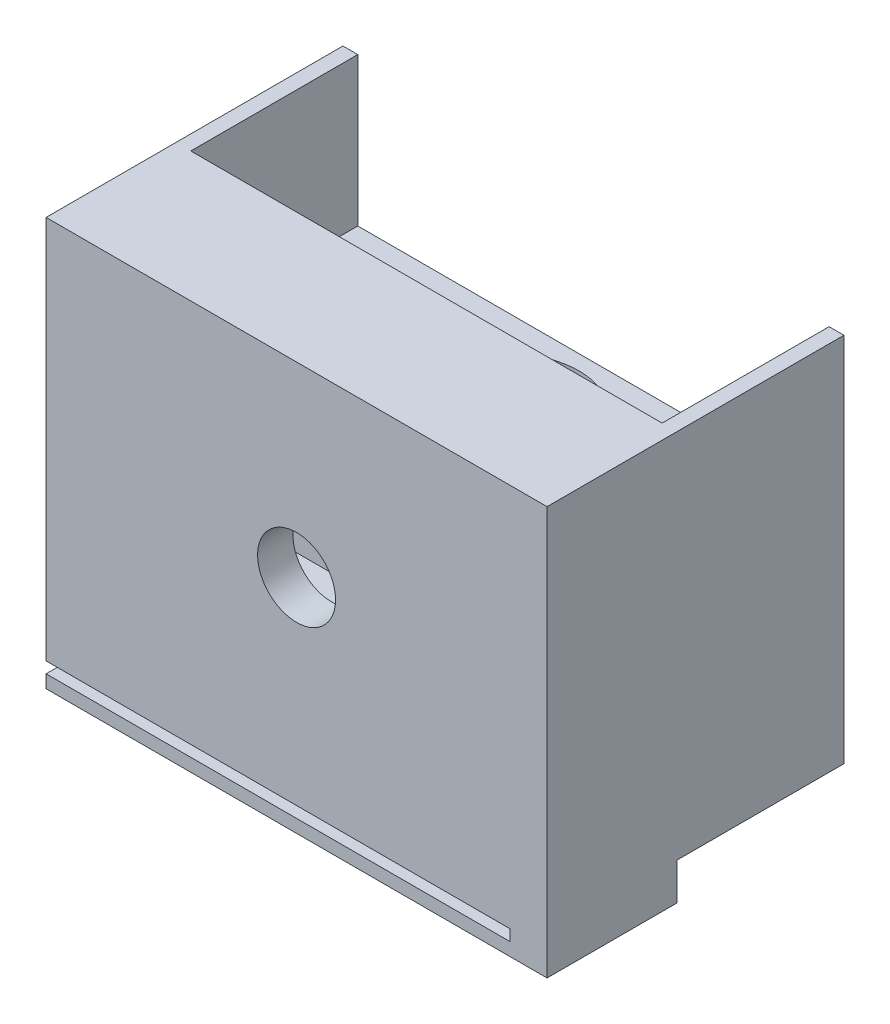
from build123d import *

# Parameters (mm, degrees)
SKETCH1_R           = 13.5
SKETCH1_R_2         = 18.5
BOSS_EXTRUDE1_DEPTH = 100
CUT_EXTRUDE1_DEPTH  = 11.5
SKETCH4_R           = 0.7
CUT_EXTRUDE2_DEPTH  = 10
SKETCH5_W           = 127
SKETCH5_H           = 47.647991038
CUT_EXTRUDE3_DEPTH  = 40
SKETCH6_R           = 7.5
SKETCH6_W           = 16
SKETCH6_H           = 40
CUT_EXTRUDE4_DEPTH  = 92.5
SKETCH10_R          = 10.5
CUT_EXTRUDE5_DEPTH  = 25.5
SKETCH11_W          = 135
SKETCH11_H          = 35
BOSS_EXTRUDE2_DEPTH = 10
SKETCH12_W          = 31.059733337
SKETCH12_H          = 3
CUT_EXTRUDE6_DEPTH  = 125
SKETCH13_R          = 5
CUT_EXTRUDE8_DEPTH  = 10
SKETCH14_R          = 10
CUT_EXTRUDE9_DEPTH  = 2


with BuildPart() as part:
    # Sketch1 → Boss-Extrude1 (new body)
    with BuildSketch(Plane(origin=(0, 0, 0), x_dir=(1, 0, 0), z_dir=(0, 1, 0))):
        Polygon((-82.5, 0), (-82.5, -35), (52.5, -35), (52.5, 0), (52.5, 45), (-82.5, 45), align=None)
        with Locations(Location((-60, 22.5, 0), (0, 0, 270))):
            Circle(SKETCH1_R, mode=Mode.SUBTRACT)
        with Locations(Location((-15, 22.5, 0), (0, 0, 270))):
            Circle(SKETCH1_R_2, mode=Mode.SUBTRACT)
        with Locations(Location((30, 22.5, 0), (0, 0, 270))):
            Circle(SKETCH1_R, mode=Mode.SUBTRACT)
    extrude(amount=BOSS_EXTRUDE1_DEPTH)

    # Sketch3 → Cut-Extrude1 (cut)
    with BuildSketch(Plane.XZ):
        with BuildLine():
            Line((-32.158714626, -40.681818182), (2.158714626, -40.681818182))
            ThreePointArc((2.158714626, -40.681818182), (10, -22.5), (2.158714626, -4.318181818))
            Line((2.158714626, -4.318181818), (-32.158714626, -4.318181818))
            ThreePointArc((-32.158714626, -4.318181818), (-40, -22.5), (-32.158714626, -40.681818182))
        make_face()
    extrude(amount=-CUT_EXTRUDE1_DEPTH, mode=Mode.SUBTRACT)

    # Sketch4 → Cut-Extrude2 (cut)
    with BuildSketch(Plane.XZ.offset(-11.5)):
        with Locations(Location((-36.25, -22.5, 0), (0, 0, 270))):
            Circle(SKETCH4_R)
        with Locations(Location((-30.0260191, -7.4739809, 0), (0, 0, 270))):
            Circle(SKETCH4_R)
        with Locations(Location((0.0260191, -7.4739809, 0), (0, 0, 270))):
            Circle(SKETCH4_R)
        with Locations(Location((6.25, -22.5, 0), (0, 0, 270))):
            Circle(SKETCH4_R)
        with Locations(Location((0.0260191, -37.5260191, 0), (0, 0, 270))):
            Circle(SKETCH4_R)
        with Locations(Location((-30.0260191, -37.5260191, 0), (0, 0, 270))):
            Circle(SKETCH4_R)
    extrude(amount=-CUT_EXTRUDE2_DEPTH, mode=Mode.SUBTRACT)

    # Sketch5 → Cut-Extrude3 (cut)
    with BuildSketch(Plane(origin=(0, 100, 0), x_dir=(1, 0, 0), z_dir=(0, 1, 0))):
        with Locations((-15, 23.823995519)):
            Rectangle(SKETCH5_W, SKETCH5_H)
    extrude(amount=-CUT_EXTRUDE3_DEPTH, mode=Mode.SUBTRACT)

    # Sketch6 → Cut-Extrude4 (cut)
    with BuildSketch(Plane.ZY.offset(82.5)):
        with Locations((17.5, 85)):
            Circle(SKETCH6_R)
        with Locations(Location((17.5, 15, 0), (0, 0, 180))):
            Circle(SKETCH6_R)
        with Locations((17.5, 50)):
            Rectangle(SKETCH6_W, SKETCH6_H)
    extrude(amount=-CUT_EXTRUDE4_DEPTH, mode=Mode.SUBTRACT)

    # Sketch10 → Cut-Extrude5 (cut)
    with BuildSketch(Plane.XY.offset(35)):
        with Locations((-15, 49.733985677)):
            Circle(SKETCH10_R)
    extrude(amount=-CUT_EXTRUDE5_DEPTH, mode=Mode.SUBTRACT)

    # Sketch11 → Boss-Extrude2 (add)
    with BuildSketch(Plane.XZ):
        with Locations((-15, 17.5)):
            Rectangle(SKETCH11_W, SKETCH11_H)
    extrude(amount=BOSS_EXTRUDE2_DEPTH)

    # Sketch12 → Cut-Extrude6 (cut)
    with BuildSketch(Plane.ZY.offset(82.5)):
        with Locations((20.529866669, -5)):
            Rectangle(SKETCH12_W, SKETCH12_H)
    extrude(amount=-CUT_EXTRUDE6_DEPTH, mode=Mode.SUBTRACT)

    # Sketch13 → Cut-Extrude8 (cut)
    with BuildSketch(Plane.XZ.offset(10)):
        with Locations(Location((-62.5, 17.5, 0), (0, 0, 270))):
            Circle(SKETCH13_R)
        with Locations(Location((32.5, 17.5, 0), (0, 0, 270))):
            Circle(SKETCH13_R)
        with Locations(Location((-15, 17.5, 0), (0, 0, 270))):
            Circle(SKETCH13_R)
    extrude(amount=-CUT_EXTRUDE8_DEPTH, mode=Mode.SUBTRACT)

    # Sketch14 → Cut-Extrude9 (cut)
    with BuildSketch(Plane.XZ.offset(10)):
        with Locations(Location((-62.5, 17.5, 0), (0, 0, 270))):
            Circle(SKETCH14_R)
        with Locations(Location((-15, 17.5, 0), (0, 0, 270))):
            Circle(SKETCH14_R)
        with Locations(Location((32.5, 17.5, 0), (0, 0, 270))):
            Circle(SKETCH14_R)
    extrude(amount=-CUT_EXTRUDE9_DEPTH, mode=Mode.SUBTRACT)


solid = part.part
